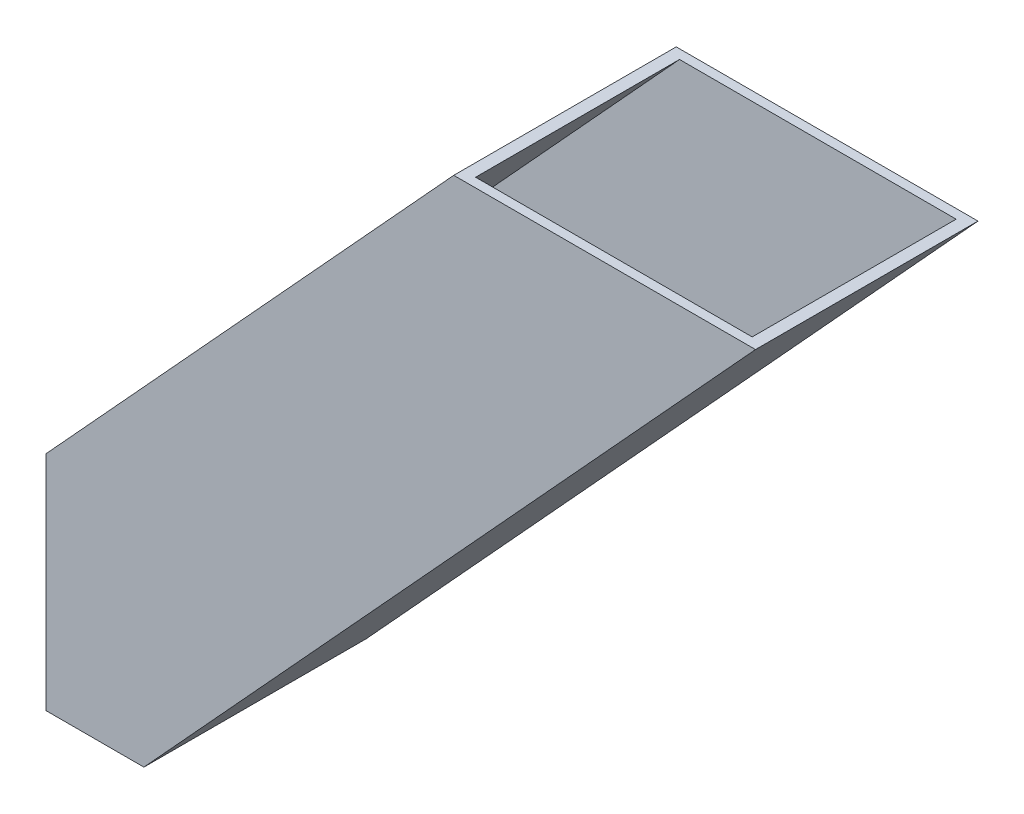
from build123d import *

# Parameters (mm, degrees)
BOSS_EXTRUDE1_DEPTH = 38.1
SHELL1_T            = -3.175
CUT_EXTRUDE6_DEPTH  = 76.2


with BuildPart() as part:
    # Sketch2 → Boss-Extrude1 (new, symmetric)
    with BuildSketch(Plane.XY):
        Polygon((46.237705824, 106.855650642), (-28.090411256, 25.739828971), (28.090411256, -25.739828971), (149.590411256, 106.855650642), align=None)
        Polygon((-28.090411256, 25.739828971), (-93.409588744, -45.544349358), (-93.409588744, -158.335308585), (28.090411256, -25.739828971), align=None)
    extrude(amount=BOSS_EXTRUDE1_DEPTH, both=True)

    # Shell1
    shell1_openings = [part.faces().sort_by_distance(p)[0] for p in [
        (97.91405854, 106.855650642, 0),
        (-93.409588744, -101.939828971, 0),
    ]]
    offset(amount=SHELL1_T, openings=shell1_openings, kind=Kind.INTERSECTION)

    # Sketch3 → Cut-Extrude6 (cut)
    with BuildSketch(Plane.XY.offset(38.1)):
        Polygon((-59.880530596, -121.744349358), (-93.409588744, -121.744349358), (-93.409588744, -158.335308585), align=None)
    extrude(amount=-CUT_EXTRUDE6_DEPTH, mode=Mode.SUBTRACT)


solid = part.part
